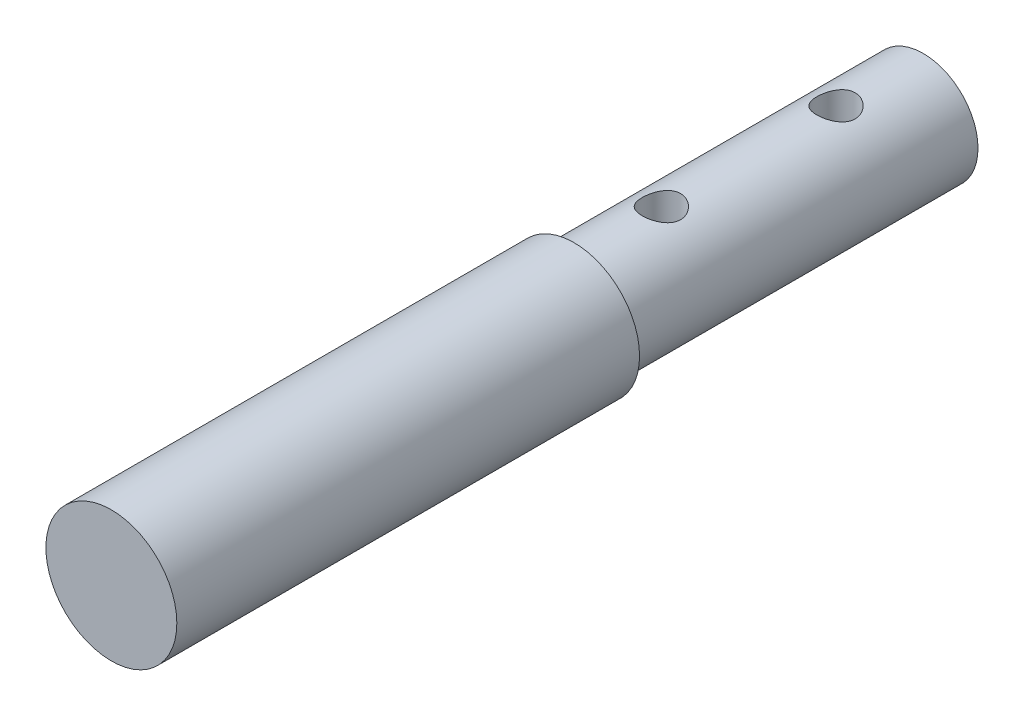
from build123d import *

# Parameters (mm, degrees)
SKETCH1_R               = 31.34
BOSS_EXTRUDE1_DEPTH     = 200
SKETCH2_R               = 37.5
BOSS_EXTRUDE2_DEPTH     = 265
CUT_EXTRUDE1_DEPTH      = 469.014422855
CUT_EXTRUDE1_DEPTH_BACK = 469.014422855
SKETCH3_R               = 11


with BuildPart() as part:
    # Sketch1 → Boss-Extrude1 (new body)
    with BuildSketch(Plane.XY):
        Circle(SKETCH1_R)
    extrude(amount=BOSS_EXTRUDE1_DEPTH)

    # Sketch2 → Boss-Extrude2 (add)
    with BuildSketch(Plane.XY.offset(200)):
        Circle(SKETCH2_R)
    extrude(amount=BOSS_EXTRUDE2_DEPTH)

    # Sketch3 → Cut-Extrude1 (cut, two sides: drawn at the far end of the back side and taken through both)
    with BuildSketch(Plane(origin=(0, 0, 0), x_dir=(1, 0, 0), z_dir=(0, 1, 0)).offset(-CUT_EXTRUDE1_DEPTH_BACK)):
        with Locations(Location((0, -150, 0), (0, 0, 270))):
            Circle(SKETCH3_R)
        with Locations(Location((0, -50, 0), (0, 0, 270))):
            Circle(SKETCH3_R)
    extrude(amount=CUT_EXTRUDE1_DEPTH + CUT_EXTRUDE1_DEPTH_BACK, mode=Mode.SUBTRACT)


solid = part.part
